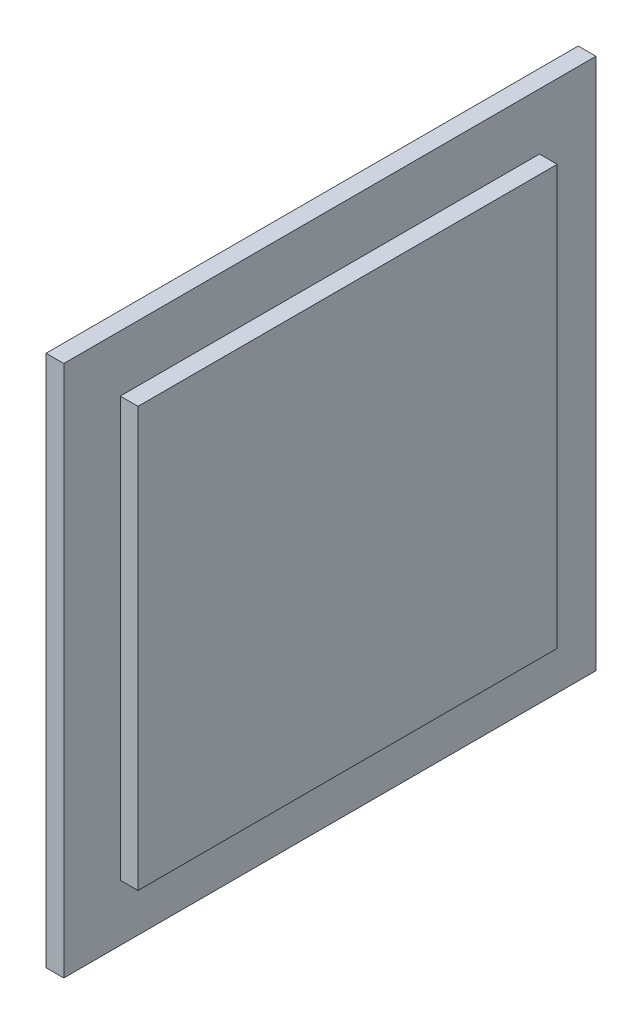
from build123d import *

# Parameters (mm, degrees)
SKETCH1_W           = 228.6
SKETCH1_H           = 228.6
SKETCH1_W_2         = 180.086
SKETCH1_H_2         = 180.086
BOSS_EXTRUDE1_DEPTH = 7.62
BOSS_EXTRUDE2_START = 7.62
SKETCH1_3_W         = 180.086
SKETCH1_3_H         = 180.086
BOSS_EXTRUDE2_DEPTH = 7.62


with BuildPart() as part:
    # Sketch1 → Boss-Extrude1 (new body)
    # profile 1 of 2: a face of its own
    with BuildSketch(Plane(origin=(0, 0, 0), x_dir=(0, 0, -1), z_dir=(1, 0, 0))):
        with Locations((114.3, -114.3)):
            Rectangle(SKETCH1_W, SKETCH1_H)
        with Locations((114.3, -114.3)):
            Rectangle(SKETCH1_W_2, SKETCH1_H_2, mode=Mode.SUBTRACT)
    # profile 2 of 2: a face of its own
    with BuildSketch(Plane(origin=(0, 0, 0), x_dir=(0, 0, -1), z_dir=(1, 0, 0))):
        with Locations((114.3, -114.3)):
            Rectangle(SKETCH1_W_2, SKETCH1_H_2)
    extrude(amount=BOSS_EXTRUDE1_DEPTH)

    # Sketch1<3> → Boss-Extrude2 (add)
    with BuildSketch(Plane(origin=(0, 0, 0), x_dir=(0, 0, -1), z_dir=(1, 0, 0)).offset(BOSS_EXTRUDE2_START)):
        with Locations((114.3, -114.3)):
            Rectangle(SKETCH1_3_W, SKETCH1_3_H)
    extrude(amount=BOSS_EXTRUDE2_DEPTH)


solid = part.part
